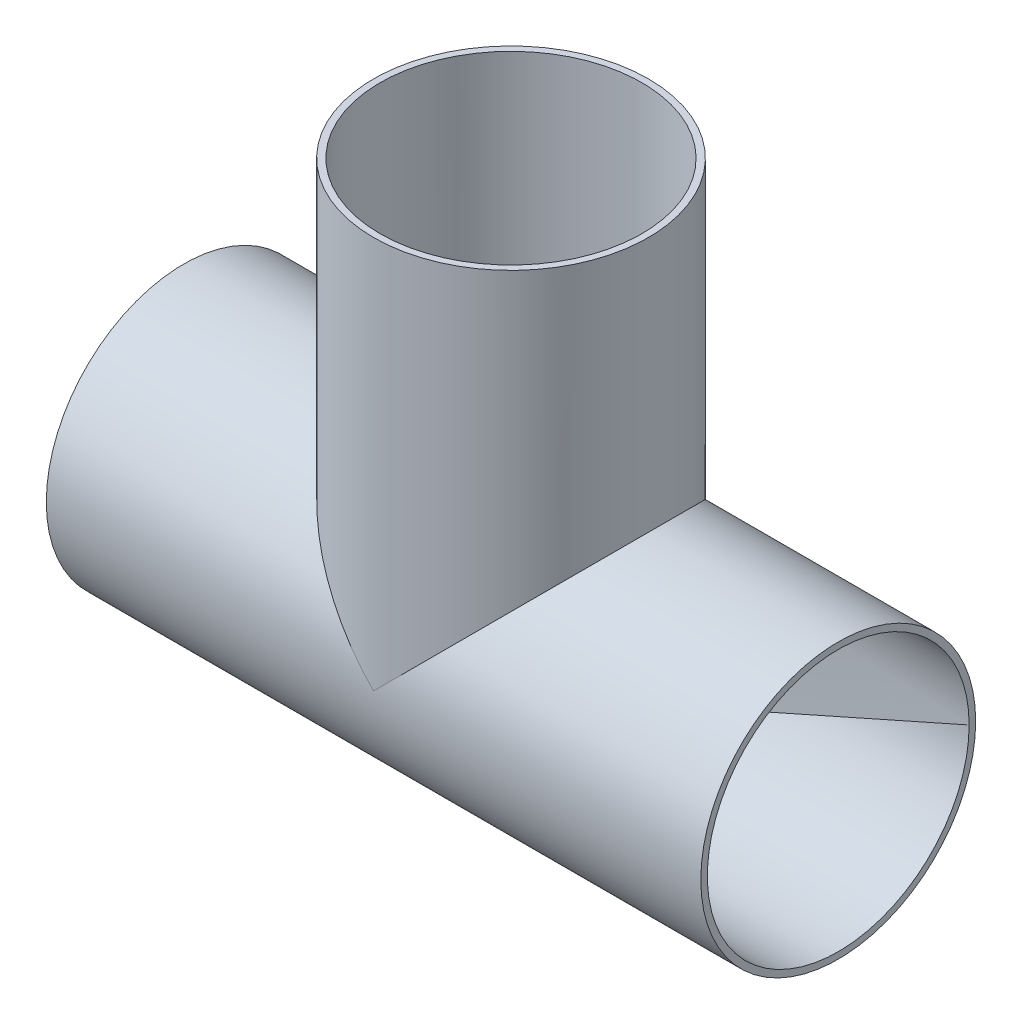
from build123d import *
from build123d.topology import SkipClean

# Parameters (mm, degrees)
SKETCH1_R           = 52.5
SKETCH1_R_2         = 50
BOSS_EXTRUDE1_DEPTH = 125
SKETCH2_R           = 52.5
SKETCH2_R_2         = 50
BOSS_EXTRUDE2_DEPTH = 150
CUT_EXTRUDE1_REACH  = 245.696
SKETCH3_R           = 50
SKETCH6_R           = 50
CUT_EXTRUDE2_DEPTH  = 297.236814188


with BuildPart() as part:
    # Sketch1 → Boss-Extrude1 (new, symmetric)
    with BuildSketch(Plane(origin=(0, 0, 0), x_dir=(0, 0, -1), z_dir=(1, 0, 0))):
        Circle(SKETCH1_R)
        Circle(SKETCH1_R_2, mode=Mode.SUBTRACT)
    extrude(amount=BOSS_EXTRUDE1_DEPTH, both=True)

    # Sketch2 → Boss-Extrude2 (add)
    with BuildSketch(Plane(origin=(0, 0, 0), x_dir=(1, 0, 0), z_dir=(0, 1, 0))):
        with Locations(Location((0, 0, 0), (0, 0, 270))):
            Circle(SKETCH2_R)
        with Locations(Location((0, 0, 0), (0, 0, 90))):
            Circle(SKETCH2_R_2, mode=Mode.SUBTRACT)
    extrude(amount=BOSS_EXTRUDE2_DEPTH)

    # Sketch3 → Cut-Extrude1 (cut, up to next)
    with BuildSketch(Plane(origin=(0, 150, 0), x_dir=(1, 0, 0), z_dir=(0, 1, 0)), mode=Mode.PRIVATE) as cut_extrude1_sk1:
        with Locations(Location((0, 0, 0), (0, 0, 270))):
            Circle(SKETCH3_R)
    cut_extrude1_tool1 = extrude(cut_extrude1_sk1.sketch, amount=-CUT_EXTRUDE1_REACH, mode=Mode.PRIVATE) & part.part
    add(cut_extrude1_tool1.solids().sort_by_distance((0, 150, 0))[0], mode=Mode.SUBTRACT)

    # Sketch6 → Cut-Extrude2 (cut, through all)
    with SkipClean():  # the faces are left unmerged after this step: merging them gives an invalid solid
        with BuildSketch(Plane.ZY.offset(125)):
            with Locations(Location((0, 0, 0), (0, 0, 180))):
                Circle(SKETCH6_R)
        extrude(amount=-CUT_EXTRUDE2_DEPTH, mode=Mode.SUBTRACT)


solid = part.part
